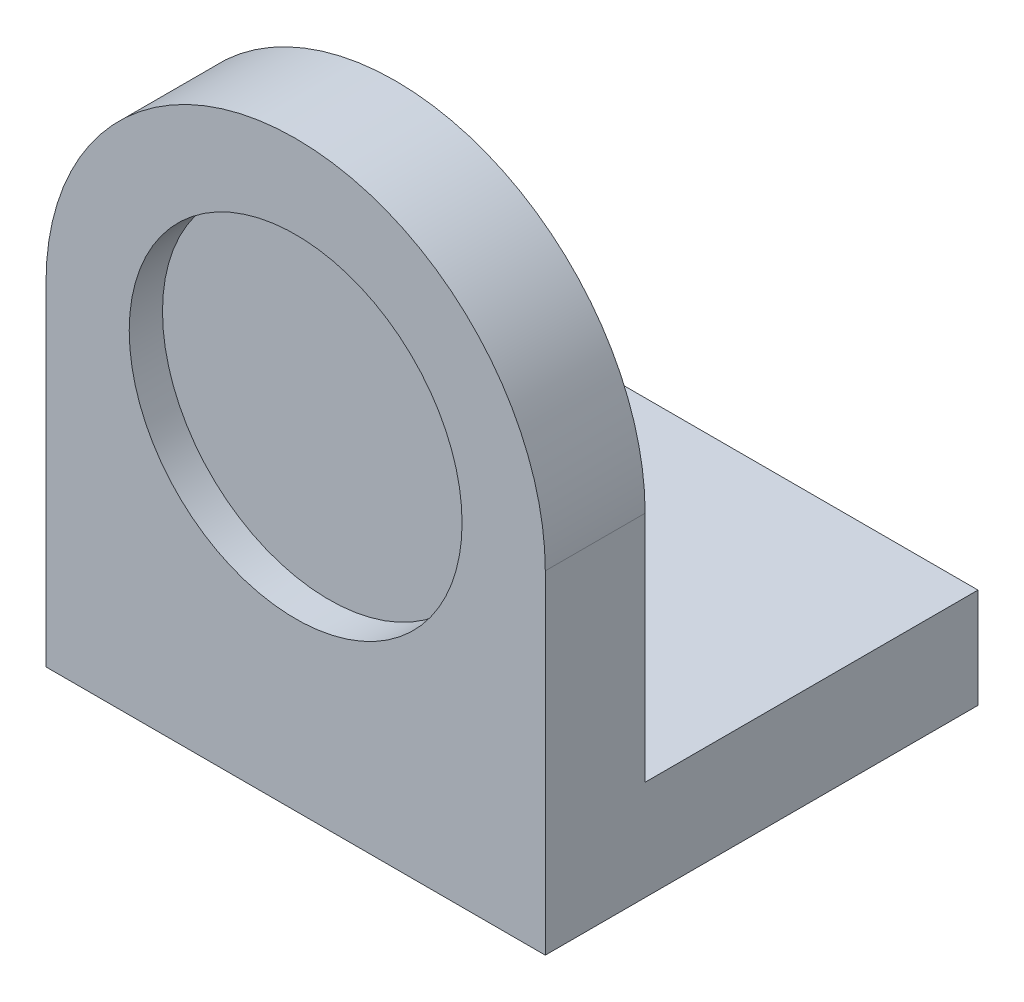
from build123d import *

# Parameters (mm, degrees)
SKETCH6_R           = 5
BOSS_EXTRUDE5_DEPTH = 3
SKETCH7_R           = 5
BOSS_EXTRUDE6_DEPTH = 2
SKETCH8_W           = 15
SKETCH8_H           = 3
BOSS_EXTRUDE7_DEPTH = 10


with BuildPart() as part:
    # Sketch6 → Boss-Extrude5 (new body)
    with BuildSketch(Plane.XY):
        with BuildLine():
            Line((-7.5, 0), (-7.5, -10))
            Line((-7.5, -10), (7.5, -10))
            Line((7.5, -10), (7.5, 0))
            ThreePointArc((7.5, 0), (0, 7.5), (-7.5, 0))
        make_face()
        Circle(SKETCH6_R, mode=Mode.SUBTRACT)
    extrude(amount=BOSS_EXTRUDE5_DEPTH)

    # Sketch7 → Boss-Extrude6 (add)
    with BuildSketch(Plane(origin=(0, 0, 0), x_dir=(-1, 0, 0), z_dir=(0, 0, -1))):
        Circle(SKETCH7_R)
    extrude(amount=-BOSS_EXTRUDE6_DEPTH)

    # Sketch8 → Boss-Extrude7 (add)
    with BuildSketch(Plane(origin=(0, 0, 0), x_dir=(-1, 0, 0), z_dir=(0, 0, -1))):
        with Locations((0, -8.5)):
            Rectangle(SKETCH8_W, SKETCH8_H)
    extrude(amount=BOSS_EXTRUDE7_DEPTH)


solid = part.part
